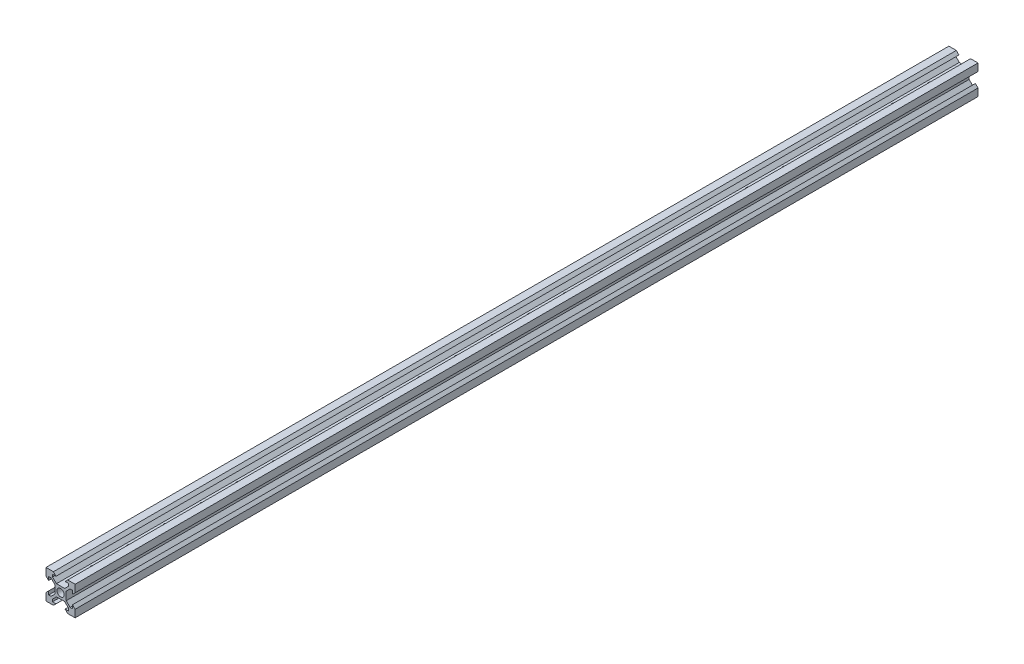
from build123d import *

# Parameters (mm, degrees)
SKETCH1_R            = 2.5
BOSS_EXTRUDE1_DEPTH  = 620
SKETCH2_R            = 1.5
CUT_EXTRUDE1_DEPTH   = 10
LPATTERN1_COUNT      = 13
LPATTERN1_PITCH      = 25
LPATTERN1_COUNT_DIR2 = 13
LPATTERN1_PITCH_DIR2 = 25


with BuildPart() as part:
    # Sketch1 → Boss-Extrude1 (new body)
    with BuildSketch(Plane.XY):
        Polygon((2.839339828, 3.9), (-2.839339828, 3.9), (-5.5, 6.560660172), (-5.5, 8.2), (-3.1, 8.2), (-4.9, 10), (-10, 10), (-10, 4.9), (-8.2, 3.1), (-8.2, 5.5), (-6.560660172, 5.5), (-3.9, 2.839339828), (-3.9, -2.839339828), (-6.560660172, -5.5), (-8.2, -5.5), (-8.2, -3.1), (-10, -4.9), (-10, -10), (-4.9, -10), (-3.1, -8.2), (-5.5, -8.2), (-5.5, -6.560660172), (-2.839339828, -3.9), (2.839339828, -3.9), (5.5, -6.560660172), (5.5, -8.2), (3.1, -8.2), (4.9, -10), (10, -10), (10, -4.9), (8.2, -3.1), (8.2, -5.5), (6.560660172, -5.5), (3.9, -2.839339828), (3.9, 2.839339828), (6.560660172, 5.5), (8.2, 5.5), (8.2, 3.1), (10, 4.9), (10, 10), (4.9, 10), (3.1, 8.2), (5.5, 8.2), (5.5, 6.560660172), align=None)
        Circle(SKETCH1_R, mode=Mode.SUBTRACT)
    extrude(amount=BOSS_EXTRUDE1_DEPTH)

    # Sketch2 → Cut-Extrude1 (cut)
    with BuildSketch(Plane(origin=(0, 3.9, 0), x_dir=(1, 0, 0), z_dir=(0, 1, 0))):
        with Locations(Location((0, -297.5, 0), (0, 0, 270))):
            Circle(SKETCH2_R)
    cut_extrude1 = extrude(amount=-CUT_EXTRUDE1_DEPTH, mode=Mode.SUBTRACT)

    # LPattern1: Cut-Extrude1 13 × 13
    with Locations(*[Vector(0, 0, 1) * (i * LPATTERN1_PITCH) + Vector(0, 0, -1) * (j * LPATTERN1_PITCH_DIR2) for i in range(LPATTERN1_COUNT) for j in range(LPATTERN1_COUNT_DIR2) if (i, j) != (0, 0)]):
        add(cut_extrude1, mode=Mode.SUBTRACT)


solid = part.part
